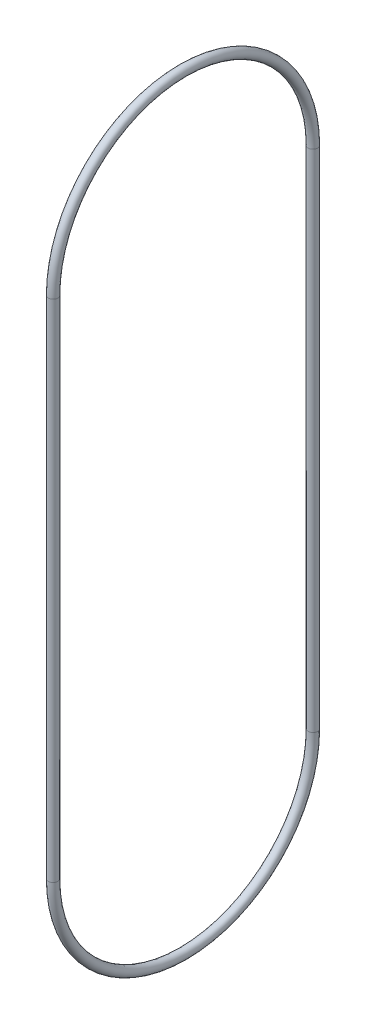
from build123d import *

# Parameters (mm, degrees)
SKETCH3_R = 1.190625


with BuildPart() as part:
    # Sweep1: sweep along a path in Sketch2
    with BuildLine(Plane(origin=(0, 0, 0), x_dir=(0, 0, -1), z_dir=(1, 0, 0))) as sweep1_path:
        Line((32.54375, 126.548151272), (32.54375, 0))
        ThreePointArc((32.54375, 0), (0, -32.54375), (-32.54375, 0))
        Line((-32.54375, 0), (-32.54375, 126.548151272))
        ThreePointArc((-32.54375, 126.548151272), (0, 159.091901272), (32.54375, 126.548151272))
    # Sketch3 → Sweep1 (sweep)
    with BuildSketch(Plane(origin=(0, 0, 0), x_dir=(1, 0, 0), z_dir=(0, 1, 0))):
        with Locations((0, -32.54375)):
            Circle(SKETCH3_R)
    sweep(path=sweep1_path.line)


solid = part.part
